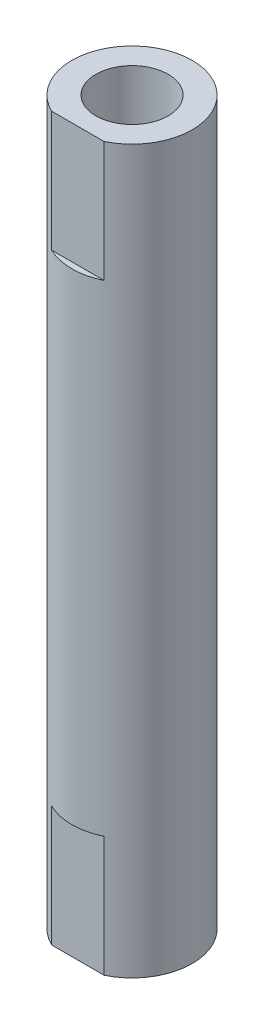
from build123d import *

# Parameters (mm, degrees)
SKETCH1_R           = 5
SKETCH1_R_2         = 3
BOSS_EXTRUDE1_DEPTH = 30
CUT_EXTRUDE1_START  = -10
CUT_EXTRUDE1_DEPTH  = 10


with BuildPart() as part:
    # Sketch1 → Boss-Extrude1 (new, symmetric)
    with BuildSketch(Plane(origin=(0, 0, 0), x_dir=(1, 0, 0), z_dir=(0, 1, 0))):
        with Locations(Location((0, 0, 0), (0, 0, 270))):
            Circle(SKETCH1_R)
        with Locations(Location((0, 0, 0), (0, 0, 270))):
            Circle(SKETCH1_R_2, mode=Mode.SUBTRACT)
    extrude(amount=BOSS_EXTRUDE1_DEPTH, both=True)

    # Sketch2 → Cut-Extrude1 (cut)
    with BuildSketch(Plane.XZ.offset(30).offset(CUT_EXTRUDE1_START)):
        with BuildLine():
            Line((-2.179449472, 4.5), (2.179449472, 4.5))
            ThreePointArc((2.179449472, 4.5), (0, 5), (-2.179449472, 4.5))
        make_face()
    cut_extrude1 = extrude(amount=CUT_EXTRUDE1_DEPTH, mode=Mode.SUBTRACT)

    # Mirror1: Cut-Extrude1 across plane
    add(cut_extrude1.mirror(Plane.ZX), mode=Mode.SUBTRACT)


solid = part.part
